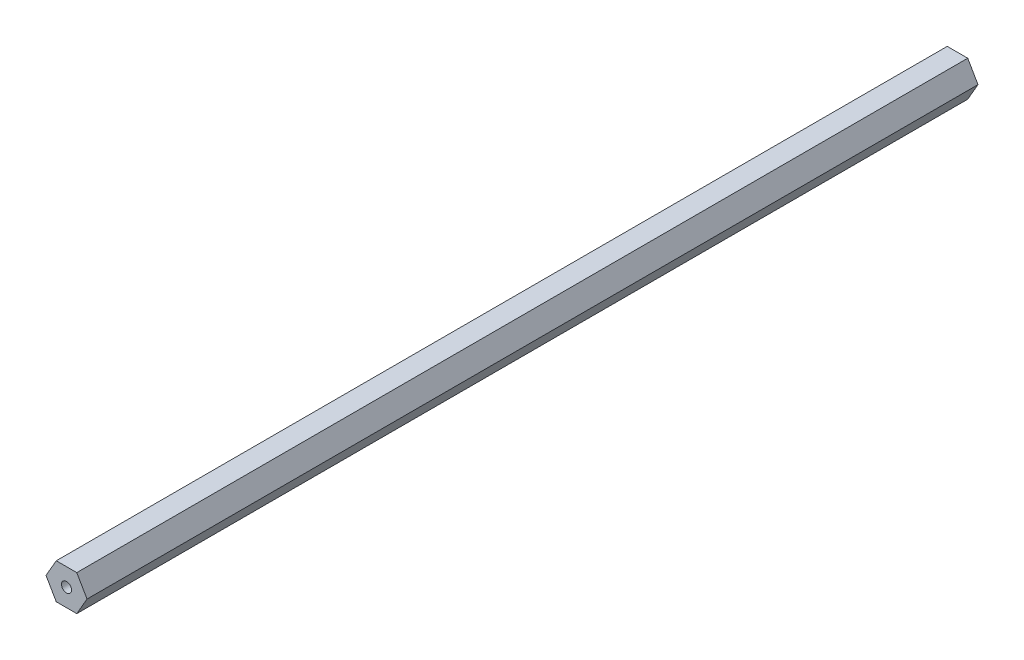
from build123d import *

# Parameters (mm, degrees)
EXTRUDE_1_DEPTH     = 178
SKETCH_2_R          = 1
CUT_EXTRUDE_1_DEPTH = 178


with BuildPart() as part:
    # 草图1 → 凸台-拉伸1 (new body)
    with BuildSketch(Plane.XY):
        Polygon((4.099186911, 0), (2.049593456, 3.55), (-2.049593456, 3.55), (-4.099186911, 0), (-2.049593456, -3.55), (2.049593456, -3.55), align=None)
    extrude(amount=EXTRUDE_1_DEPTH)

    # 草图2 → 切除-拉伸1 (cut)
    with BuildSketch(Plane.XY.offset(178)):
        Circle(SKETCH_2_R)
    extrude(amount=-CUT_EXTRUDE_1_DEPTH, mode=Mode.SUBTRACT)


solid = part.part
